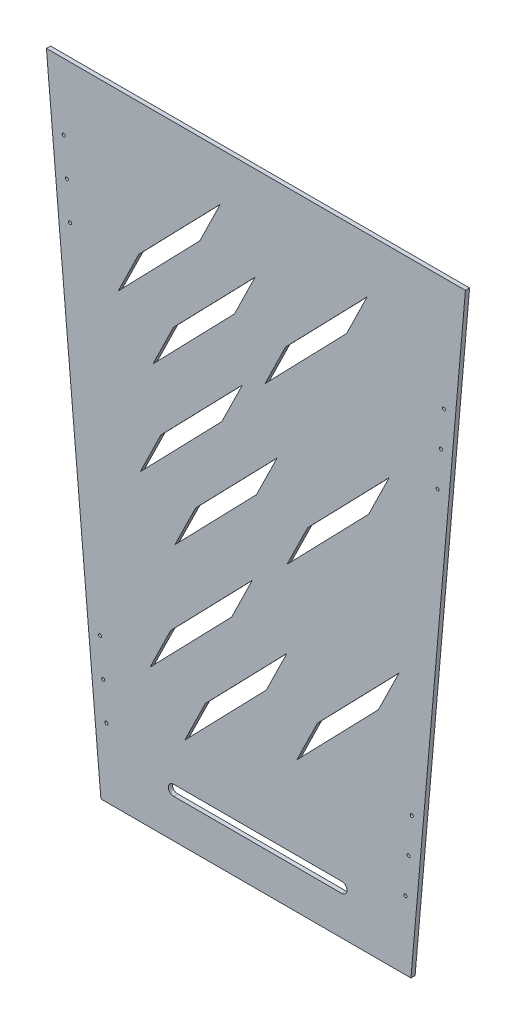
from build123d import *

# Parameters (mm, degrees)
SKETCH2_R           = 1.5
BOSS_EXTRUDE1_DEPTH = 4
CUT_EXTRUDE1_DEPTH  = 10
CUT_EXTRUDE2_DEPTH  = 10


with BuildPart() as part:
    # Sketch2 → Boss-Extrude1 (new body)
    with BuildSketch(Plane.XY):
        Polygon((-201.085, 510.519303279), (-148.79, -87.200696721), (148.79, -87.200696721), (201.085, 510.519303279), align=None)
        with Locations((-143.497000101, -21.490696721)):
            Circle(SKETCH2_R, mode=Mode.SUBTRACT)
        with Locations((-146.547451097, 13.376117712)):
            Circle(SKETCH2_R, mode=Mode.SUBTRACT)
        with Locations((-149.597902093, 48.242932145)):
            Circle(SKETCH2_R, mode=Mode.SUBTRACT)
        with Locations((-178.360333434, 376.989303279)):
            Circle(SKETCH2_R, mode=Mode.SUBTRACT)
        with Locations((-181.410784431, 411.856117712)):
            Circle(SKETCH2_R, mode=Mode.SUBTRACT)
        with Locations((-184.461235427, 446.722932145)):
            Circle(SKETCH2_R, mode=Mode.SUBTRACT)
        with Locations(Location((143.497000101, -21.490696721, 0), (0, 0, 180))):
            Circle(SKETCH2_R, mode=Mode.SUBTRACT)
        with Locations(Location((146.547451097, 13.376117712, 0), (0, 0, 180))):
            Circle(SKETCH2_R, mode=Mode.SUBTRACT)
        with Locations(Location((149.597902093, 48.242932145, 0), (0, 0, 180))):
            Circle(SKETCH2_R, mode=Mode.SUBTRACT)
        with Locations((180.519233461, 401.665041377)):
            Circle(SKETCH2_R, mode=Mode.SUBTRACT)
        with Locations((177.468708595, 366.798233406)):
            Circle(SKETCH2_R, mode=Mode.SUBTRACT)
        with Locations((174.418183729, 331.931425436)):
            Circle(SKETCH2_R, mode=Mode.SUBTRACT)
    extrude(amount=BOSS_EXTRUDE1_DEPTH)

    # Sketch4 → Cut-Extrude1 (cut)
    with BuildSketch(Plane.XY.offset(4)):
        Polygon((-34.094299882, 464.527144648), (-112.369249077, 383.780354951), (-132.143973084, 343.406960103), (-53.869023889, 424.153749799), align=None)
        Polygon((-0.812513571, 420.480908047), (-79.087462766, 339.73411835), (-98.862186773, 299.360723502), (-20.587237578, 380.107513199), align=None)
        Polygon((106.781302599, 457.941673616), (28.506353404, 377.19488392), (8.731629397, 336.821489072), (87.006578592, 417.568278768), align=None)
        Polygon((-12.949090157, 324.872537818), (-91.224039352, 244.125748122), (-110.99876336, 203.752353274), (-32.723814164, 284.49914297), align=None)
        Polygon((20.332696154, 280.826301217), (-57.942253041, 200.079511521), (-77.716977049, 159.706116673), (0.557972147, 240.452906369), align=None)
        Polygon((127.926512324, 318.287066787), (49.651563128, 237.54027709), (29.876839121, 197.166882242), (108.151788317, 277.913671939), align=None)
        Polygon((-3.521579741, 167.145743121), (-81.796528937, 86.398953425), (-101.571252944, 46.025558577), (-23.296303748, 126.772348273), align=None)
        Polygon((29.76020657, 123.09950652), (-48.514742626, 42.352716824), (-68.289466633, 1.979321976), (9.985482563, 82.726111672), align=None)
        Polygon((137.35402274, 160.560272089), (59.079073544, 79.813482393), (39.304349537, 39.440087545), (117.579298732, 120.186877241), align=None)
    extrude(amount=-CUT_EXTRUDE1_DEPTH, mode=Mode.SUBTRACT)

    # Sketch5 → Cut-Extrude2 (cut)
    with BuildSketch(Plane.XY.offset(4)):
        with BuildLine():
            Line((-79.098896029, -40.056454397), (82.394683364, -40.056454397))
            ThreePointArc((82.394683364, -40.056454397), (87.394683364, -45.056454397), (82.394683364, -50.056454397))
            Line((82.394683364, -50.056454397), (-79.098896029, -50.056454397))
            ThreePointArc((-79.098896029, -50.056454397), (-84.098896029, -45.056454397), (-79.098896029, -40.056454397))
        make_face()
    extrude(amount=-CUT_EXTRUDE2_DEPTH, mode=Mode.SUBTRACT)


solid = part.part
